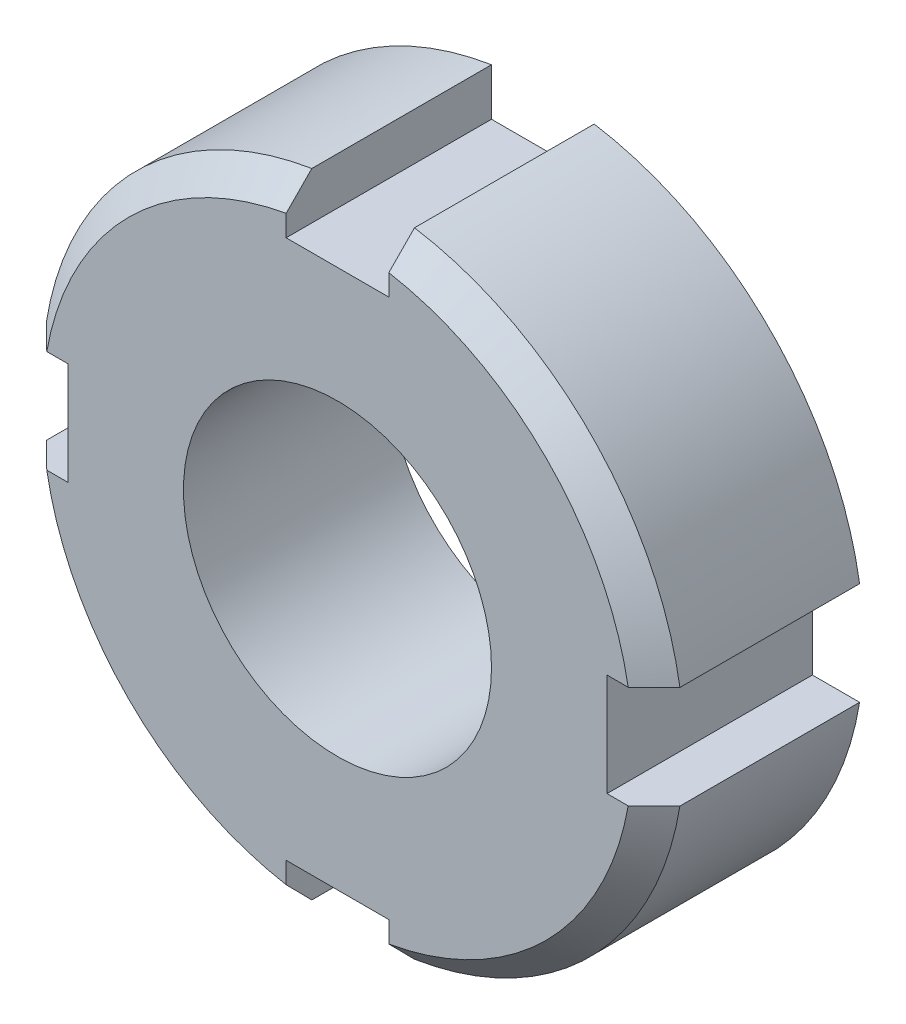
from build123d import *

# Parameters (mm, degrees)
SKETCH1_R           = 12.5
BOSS_EXTRUDE1_DEPTH = 8
SKETCH2_R           = 6
CUT_EXTRUDE1_DEPTH  = 20.403607912
SKETCH3_W           = 4
SKETCH3_H           = 4
CUT_EXTRUDE2_DEPTH  = 20.403607912
CHAMFER1_SIZE       = 1


with BuildPart() as part:
    # Sketch1 → Boss-Extrude1 (new body)
    with BuildSketch(Plane.XY):
        Circle(SKETCH1_R)
    extrude(amount=BOSS_EXTRUDE1_DEPTH)

    # Sketch2 → Cut-Extrude1 (cut, through all)
    with BuildSketch(Plane.XY.offset(8)):
        Circle(SKETCH2_R)
    extrude(amount=-CUT_EXTRUDE1_DEPTH, mode=Mode.SUBTRACT)

    # Sketch3 → Cut-Extrude2 (cut, through all)
    with BuildSketch(Plane.XY.offset(8)):
        with Locations((12.5, 0)):
            Rectangle(SKETCH3_W, SKETCH3_H)
        with Locations((0, 12.5)):
            Rectangle(SKETCH3_W, SKETCH3_H)
        with Locations((0, -12.5)):
            Rectangle(SKETCH3_W, SKETCH3_H)
        with Locations((-12.5, 0)):
            Rectangle(SKETCH3_W, SKETCH3_H)
    extrude(amount=-CUT_EXTRUDE2_DEPTH, mode=Mode.SUBTRACT)

    # Chamfer1
    chamfer1_edges = [part.edges().sort_by_distance(p)[0] for p in [
        (-8.838834765, 8.838834765, 8),
        (-8.838834765, -8.838834765, 8),
        (8.838834765, -8.838834765, 8),
        (8.838834765, 8.838834765, 8),
    ]]
    chamfer(chamfer1_edges, length=CHAMFER1_SIZE)


solid = part.part
